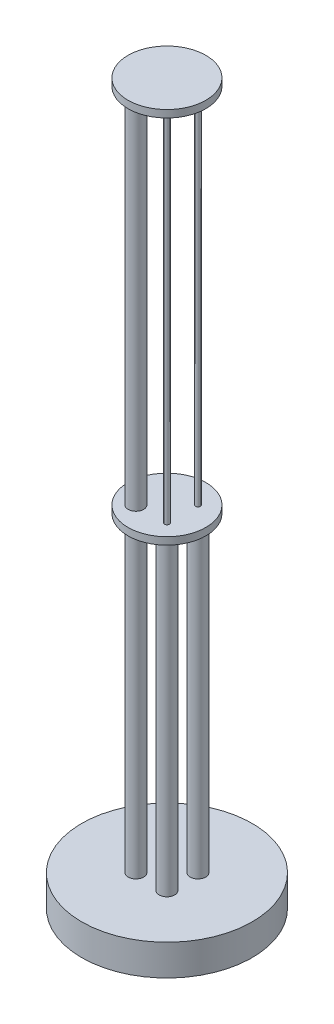
from build123d import *

# Parameters (mm, degrees)
SKETCH1_R           = 34.925
BOSS_EXTRUDE1_DEPTH = 12.7
SKETCH2_R           = 3.175
BOSS_EXTRUDE2_DEPTH = 130.4
SKETCH3_R           = 3.175
BOSS_EXTRUDE3_DEPTH = 151.5
SKETCH4_R           = 1
BOSS_EXTRUDE4_DEPTH = 151.5
SKETCH5_R           = 15.941442814
BOSS_EXTRUDE5_DEPTH = 3
SKETCH6_R           = 15.941442814
BOSS_EXTRUDE6_DEPTH = 3


with BuildPart() as part:
    # Sketch1 → Boss-Extrude1 (new body)
    with BuildSketch(Plane(origin=(0, 0, 0), x_dir=(1, 0, 0), z_dir=(0, 1, 0))):
        with Locations(Location((0, 0, 0), (0, 0, 270))):
            Circle(SKETCH1_R)
    extrude(amount=BOSS_EXTRUDE1_DEPTH)

    # Sketch2 → Boss-Extrude2 (add)
    with BuildSketch(Plane(origin=(0, 12.7, 0), x_dir=(1, 0, 0), z_dir=(0, 1, 0))):
        with Locations(Location((-6.35, 6.35, 0), (0, 0, 270))):
            Circle(SKETCH2_R)
        with Locations(Location((6.35, 6.35, 0), (0, 0, 90))):
            Circle(SKETCH2_R)
        with Locations(Location((6.35, -6.35, 0), (0, 0, 270))):
            Circle(SKETCH2_R)
        with Locations(Location((-6.35, -6.35, 0), (0, 0, 90))):
            Circle(SKETCH2_R)
    extrude(amount=BOSS_EXTRUDE2_DEPTH)

    # Sketch3 → Boss-Extrude3 (add)
    with BuildSketch(Plane(origin=(0, 143.1, 0), x_dir=(1, 0, 0), z_dir=(0, 1, 0))):
        with Locations(Location((-6.35, -6.35, 0), (0, 0, 90))):
            Circle(SKETCH3_R)
    extrude(amount=BOSS_EXTRUDE3_DEPTH)

    # Sketch4 → Boss-Extrude4 (add)
    with BuildSketch(Plane(origin=(0, 143.1, 0), x_dir=(1, 0, 0), z_dir=(0, 1, 0))):
        with Locations(Location((-6.35, 6.35, 0), (0, 0, 270))):
            Circle(SKETCH4_R)
        with Locations(Location((6.35, 6.35, 0), (0, 0, 90))):
            Circle(SKETCH4_R)
        with Locations(Location((6.35, -6.35, 0), (0, 0, 270))):
            Circle(SKETCH4_R)
    extrude(amount=BOSS_EXTRUDE4_DEPTH)

    # Sketch5 → Boss-Extrude5 (add)
    with BuildSketch(Plane(origin=(0, 143.1, 0), x_dir=(1, 0, 0), z_dir=(0, 1, 0))):
        with Locations(Location((0, 0, 0), (0, 0, 270))):
            Circle(SKETCH5_R)
    extrude(amount=-BOSS_EXTRUDE5_DEPTH)

    # Sketch6 → Boss-Extrude6 (add)
    with BuildSketch(Plane(origin=(0, 294.6, 0), x_dir=(1, 0, 0), z_dir=(0, 1, 0))):
        with Locations(Location((0, 0, 0), (0, 0, 270))):
            Circle(SKETCH6_R)
    extrude(amount=-BOSS_EXTRUDE6_DEPTH)


solid = part.part
